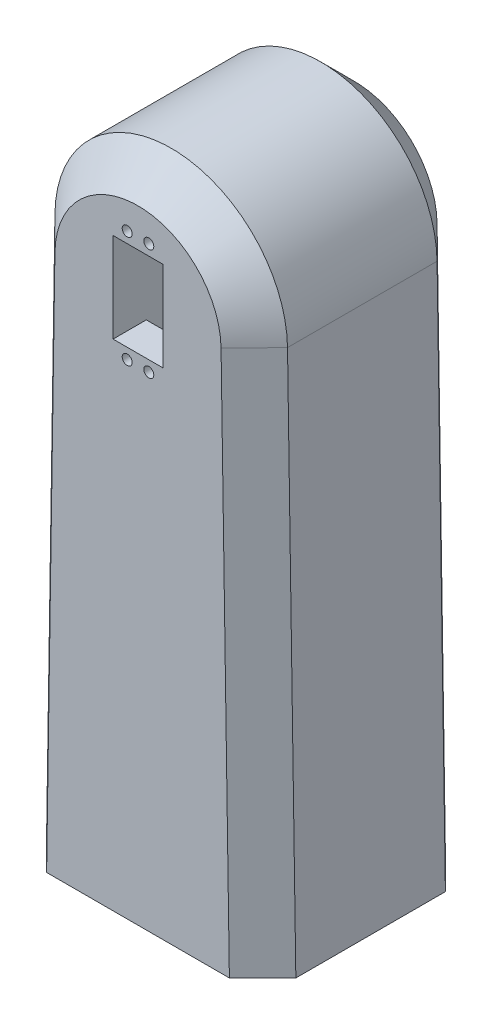
from build123d import *

# Parameters (mm, degrees)
BOSS_EXTRUDE1_DEPTH = 65
CHAMFER1_SIZE       = 10
SKETCH2_R           = 15
CUT_EXTRUDE1_DEPTH  = 5
SKETCH3_R           = 1.5
CUT_EXTRUDE2_DEPTH  = 7.5
FILLET1_R           = 1
SKETCH4_W           = 15
SKETCH4_H           = 40
CUT_EXTRUDE3_DEPTH  = 55
SKETCH5_W           = 15
SKETCH5_H           = 27
SKETCH5_R           = 1.5
CUT_EXTRUDE4_DEPTH  = 209.416650007


with BuildPart() as part:
    # Sketch1 → Boss-Extrude1 (new body)
    with BuildSketch(Plane.XY):
        with BuildLine():
            Line((-37.5, 0), (37.5, 0))
            Line((37.5, 0), (34.995872386, 163.037509012))
            ThreePointArc((34.995872386, 163.037509012), (0, 197.5), (-34.995872386, 163.037509012))
            Line((-34.995872386, 163.037509012), (-37.5, 0))
        make_face()
    extrude(amount=BOSS_EXTRUDE1_DEPTH)

    # Chamfer1
    chamfer1_edges = [part.edges().sort_by_distance(p)[0] for p in [
        (-36.247936193, 81.518754506, 65),
        (36.247936193, 81.518754506, 65),
        (-36.247936193, 81.518754506, 0),
        (0, 197.5, 0),
        (36.247936193, 81.518754506, 0),
        (0, 197.5, 65),
    ]]
    chamfer(chamfer1_edges, length=CHAMFER1_SIZE)

    # Sketch2 → Cut-Extrude1 (cut)
    with BuildSketch(Plane(origin=(0, 0, 0), x_dir=(-1, 0, 0), z_dir=(0, -1, 0))):
        with Locations(Location((0, -32.5, 0), (0, 0, 90))):
            Circle(SKETCH2_R)
    extrude(amount=-CUT_EXTRUDE1_DEPTH, mode=Mode.SUBTRACT)

    # Sketch3 → Cut-Extrude2 (cut)
    with BuildSketch(Plane(origin=(0, 5, 0), x_dir=(-1, 0, 0), z_dir=(0, -1, 0))):
        with Locations(Location((0, -40, 0), (0, 0, 90))):
            Circle(SKETCH3_R)
        with Locations(Location((-7.5, -32.5, 0), (0, 0, 90))):
            Circle(SKETCH3_R)
        with Locations(Location((0, -25, 0), (0, 0, 90))):
            Circle(SKETCH3_R)
        with Locations(Location((7.5, -32.5, 0), (0, 0, 90))):
            Circle(SKETCH3_R)
    extrude(amount=-CUT_EXTRUDE2_DEPTH, mode=Mode.SUBTRACT)

    # Fillet1
    fillet1_edges = [part.edges().sort_by_distance(p)[0] for p in [
        (0, 5, 47.5),
        (0, 0, 47.5),
    ]]
    fillet(fillet1_edges, radius=FILLET1_R)

    # Sketch4 → Cut-Extrude3 (cut)
    with BuildSketch(Plane(origin=(0, 0, 0), x_dir=(-1, 0, 0), z_dir=(0, 0, -1))):
        with Locations((0, 162.5)):
            Rectangle(SKETCH4_W, SKETCH4_H)
    extrude(amount=-CUT_EXTRUDE3_DEPTH, mode=Mode.SUBTRACT)

    # Sketch5 → Cut-Extrude4 (cut, through all)
    with BuildSketch(Plane(origin=(0, 0, 55), x_dir=(-1, 0, 0), z_dir=(0, 0, -1))):
        with Locations((0, 162.5)):
            Rectangle(SKETCH5_W, SKETCH5_H)
        with Locations((-3.25, 179.25)):
            Circle(SKETCH5_R)
        with Locations((3.25, 179.25)):
            Circle(SKETCH5_R)
        with Locations((-3.25, 145.75)):
            Circle(SKETCH5_R)
        with Locations((3.25, 145.75)):
            Circle(SKETCH5_R)
    extrude(amount=-CUT_EXTRUDE4_DEPTH, mode=Mode.SUBTRACT)


solid = part.part
